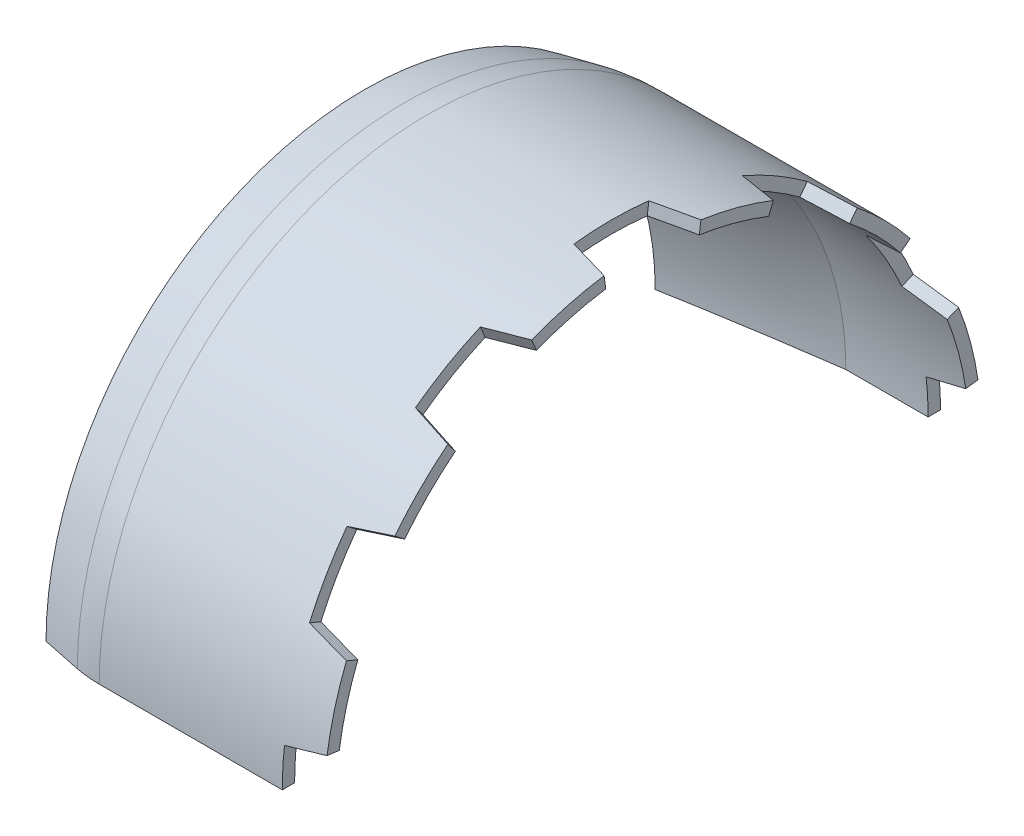
from build123d import *
from build123d.topology import SkipClean

# Parameters (mm, degrees)
FILLET1_R                      = 30
BOSS_EXTRUDE1_DEPTH            = 5
DRAFT1_ANGLE                   = 15
CIRPATTERN1_COUNT              = 12
DRAFT1_OF_CIRPATTERN1_2_ANGLE  = 15
DRAFT1_OF_CIRPATTERN1_3_ANGLE  = 15
DRAFT1_OF_CIRPATTERN1_4_ANGLE  = 15
DRAFT1_OF_CIRPATTERN1_5_ANGLE  = 15
DRAFT1_OF_CIRPATTERN1_6_ANGLE  = 15
DRAFT1_OF_CIRPATTERN1_7_ANGLE  = 15
DRAFT1_OF_CIRPATTERN1_8_ANGLE  = 15
DRAFT1_OF_CIRPATTERN1_9_ANGLE  = 15
DRAFT1_OF_CIRPATTERN1_10_ANGLE = 15
DRAFT1_OF_CIRPATTERN1_11_ANGLE = 15
DRAFT1_OF_CIRPATTERN1_12_ANGLE = 15
CUT_EXTRUDE1_START             = -65
SKETCH3_OUTSIDE_W              = 209.37
SKETCH3_OUTSIDE_H              = 209.37
CUT_EXTRUDE1_DEPTH             = 70


with BuildPart() as part:
    # Sketch1 → Revolve1 (revolve)
    with BuildSketch(Plane.XY, mode=Mode.PRIVATE) as revolve1_sk:
        with BuildLine():
            add(Edge.make_bspline(
                [(110, 77.45), (110.06679598, 77.462758264), (110.199999634, 77.490001626), (110.399807309, 77.530856913), (110.601491881, 77.566698809), (110.798508105, 77.623301255), (111.067180729, 77.671047252), (111.332818291, 77.728957106), (111.601493273, 77.776692616), (111.798502962, 77.833324125), (112.000211696, 77.869058569), (112.199929416, 77.910313895), (112.400070642, 77.94968585), (112.599788017, 77.990942706), (112.801498132, 78.026671007), (112.998502606, 78.083325711), (113.200208347, 78.119073462), (113.399943178, 78.160252691), (113.600018939, 78.199915776), (113.799981065, 78.240084206), (114.000056801, 78.279747399), (114.19979173, 78.320926197), (114.401497106, 78.356675571), (114.598502951, 78.413324175), (114.800207988, 78.449075058), (114.999944271, 78.490247831), (115.200014927, 78.529933617), (115.399996019, 78.570017702), (115.66666932, 78.623321532), (115.93333068, 78.676678468), (116.200003981, 78.729982298), (116.399985073, 78.770066382), (116.600055727, 78.809752175), (116.799792017, 78.850924917), (117.001497028, 78.886675917), (117.198502972, 78.943324083), (117.400207983, 78.979075081), (117.599944271, 79.020247831), (117.800014933, 79.059933594), (117.999995999, 79.100017793), (118.200001072, 79.139995233), (118.599998354, 79.220007319), (119.000000352, 79.299997981), (119.399999769, 79.380001322), (119.600000864, 79.419995059), (119.799996775, 79.460018442), (120.000012038, 79.499931172), (120.199955075, 79.540256871), (120.400167663, 79.579041345), (120.598813231, 79.623452318), (120.801186769, 79.646547682), (120.999832337, 79.690958656), (121.200044925, 79.729743127), (121.399987961, 79.770068835), (121.60000323, 79.809981532), (121.799999119, 79.850005037), (122.000000294, 79.889998321), (122.199999706, 79.930001679), (122.383325982, 79.966660563), (122.499982502, 79.990003775), (122.549974744, 80)],
                knots=[0.785532448, 0.785532448, 0.785532448, 0.785532448, 0.786606766, 0.787681084, 0.788755402, 0.789841279, 0.790915597, 0.793064233, 0.794138551, 0.795224429, 0.796298747, 0.797373065, 0.798447383, 0.799521701, 0.800596019, 0.801681896, 0.802756214, 0.803830532, 0.80490485, 0.805979168, 0.807053486, 0.808127804, 0.809202122, 0.810287999, 0.811362317, 0.812436636, 0.813510954, 0.814585272, 0.81565959, 0.817808226, 0.818882544, 0.819956862, 0.82103118, 0.822105498, 0.823179816, 0.824265693, 0.825340011, 0.826414329, 0.827488647, 0.828562965, 0.829637283, 0.830711601, 0.835008874, 0.836083192, 0.83715751, 0.838231828, 0.839306146, 0.840380464, 0.841454782, 0.8425291, 0.843594341, 0.844668659, 0.845742977, 0.846817295, 0.847891613, 0.848965931, 0.850040249, 0.851114567, 0.852188885, 0.852994493, 0.852994493, 0.852994493, 0.852994493], degree=3))
            Line((110, 77.45), (110, 70.659443335))
            add(Edge.make_bspline(
                [(110, 70.659443335), (110.051885566, 70.668180822), (110.167763625, 70.68872725), (110.349523568, 70.714997808), (110.539653731, 70.763669129), (110.733770096, 70.791720551), (110.925877478, 70.826475418), (111.119988954, 70.854552124), (111.310138801, 70.903121629), (111.504180998, 70.931556707), (111.696564878, 70.964881298), (111.888950575, 70.998196488), (112.082987301, 71.026659869), (112.273157347, 71.075124886), (112.531641934, 71.11304167), (112.787516212, 71.160772453), (113.046002752, 71.198679133), (113.236167385, 71.247172151), (113.430224123, 71.275532008), (113.622535313, 71.309232614), (113.815197283, 71.341118696), (114.007508188, 71.374820776), (114.20156607, 71.403174715), (114.391726383, 71.451690079), (114.585780643, 71.480062757), (114.778106006, 71.513690047), (114.970713752, 71.545856618), (115.163227378, 71.57851006), (115.355835104, 71.610676734), (115.548160548, 71.644303609), (115.742214505, 71.67267785), (115.932375954, 71.721187338), (116.126429631, 71.749563033), (116.318756196, 71.783184104), (116.511359715, 71.815372545), (116.703889049, 71.847944725), (116.960621206, 71.891237859), (117.217343471, 71.934582158), (117.474075627, 71.977875292), (117.666604962, 72.010447471), (117.859208479, 72.042635919), (118.05153505, 72.07625696), (118.245588705, 72.104632768), (118.435750235, 72.153141833), (118.629803891, 72.181517639), (118.82213046, 72.215138688), (119.014733983, 72.247327106), (119.207263297, 72.279899397), (119.399812494, 72.31236883), (119.784900235, 72.377362812), (120.169991868, 72.442336157), (120.555081398, 72.507321709), (120.747627261, 72.539806853), (120.94016902, 72.572320517), (121.132726097, 72.604727732), (121.325226005, 72.637532223), (121.517939268, 72.668854058), (121.709315773, 72.705605444), (121.903643016, 72.721851243), (122.095019521, 72.758602629), (122.287732784, 72.789924462), (122.480232691, 72.822728961), (122.672789773, 72.855136145), (122.865331515, 72.887649925), (123.05787744, 72.920134634), (123.250421971, 72.952629033), (123.442967897, 72.985113742), (123.635509639, 73.017627523), (123.82806672, 73.050034704), (124.020566627, 73.082839212), (124.213279894, 73.114161013), (124.404656382, 73.150912516), (124.598983687, 73.167157885), (124.79035996, 73.203910883), (124.98307409, 73.23522669), (125.175570762, 73.268053675), (125.368139919, 73.300376944), (125.560636595, 73.333203899), (125.753350708, 73.364519822), (125.944727043, 73.401272389), (126.139054118, 73.417519359), (126.330431471, 73.454264852), (126.587378183, 73.496057211), (126.843928932, 73.540601236), (127.100875322, 73.582395829), (127.292253557, 73.619135196), (127.486577364, 73.635404877), (127.741942359, 73.684329085), (127.999325479, 73.723088713), (128.254691564, 73.772005344), (128.449012391, 73.788295732), (128.704378458, 73.837212498), (128.961761153, 73.875975073), (129.217127225, 73.924891795), (129.411448036, 73.941182301), (129.602837526, 73.977843446), (129.795505233, 74.009481857), (129.98817434, 74.04111054), (130.179559644, 74.077800784), (130.373895725, 74.093985168), (130.565227855, 74.131044926), (130.758110028, 74.16119295), (130.949438419, 74.198278698), (131.14378938, 74.214359672), (131.335118521, 74.251440209), (131.527997688, 74.281609116), (131.719341055, 74.318590789), (131.978583116, 74.340572085), (132.231771971, 74.400758969), (132.491013633, 74.422743037), (132.682358103, 74.459717044), (132.875233151, 74.489914578), (133.066577619, 74.526888594), (133.325819288, 74.548872611), (133.579008295, 74.609058447), (133.838249971, 74.631042408), (134.029594418, 74.668016579), (134.222469549, 74.698213534), (134.413813709, 74.735189698), (134.608108919, 74.751658106), (134.799646722, 74.787288585), (134.991204892, 74.822777525), (135.185439345, 74.839668158), (135.377007721, 74.875086169), (135.568504741, 74.911000063), (135.762952059, 74.926411428), (135.953185876, 74.96724372), (136.147633173, 74.982655228), (136.339130275, 75.018568549), (136.530698343, 75.053988706), (136.789862004, 75.07651482), (137.043113602, 75.13626569), (137.302277271, 75.158791751), (137.493845318, 75.194212053), (137.685342498, 75.230124835), (137.879789507, 75.245538344), (138.070024403, 75.286363139), (138.329465202, 75.306963337), (138.582494602, 75.368258326), (138.841934984, 75.388861429), (139.032171032, 75.42967821), (139.226613759, 75.445121483), (139.418127023, 75.480922486), (139.6096351, 75.516759539), (139.804093302, 75.532095268), (139.994272403, 75.573307803), (140.188926912, 75.587279335), (140.37910609, 75.628491324), (140.638566347, 75.648956304), (140.891579327, 75.710365405), (141.151041181, 75.730819289), (141.341215956, 75.77206188), (141.535886821, 75.78591975), (141.726004669, 75.827557945), (141.920690661, 75.841310693), (142.110804714, 75.882975261), (142.305490705, 75.896728011), (142.495608554, 75.938366202), (142.690279417, 75.952224083), (142.880454198, 75.993466633), (143.139916022, 76.013920722), (143.392928397, 76.075334026), (143.652390191, 76.095788325), (143.842565055, 76.137030298), (144.037235611, 76.150890319), (144.227354613, 76.192520496), (144.422036315, 76.206303053), (144.612166432, 76.247855984), (144.806792682, 76.262023899), (145.060401779, 76.315430418), (145.320449369, 76.327953852), (145.574058436, 76.38136058), (145.768684768, 76.395527919), (145.958814575, 76.437083006), (146.153497432, 76.450857546), (146.343612113, 76.49251775), (146.538298737, 76.506266102), (146.728413418, 76.547926307), (146.923096274, 76.561700843), (147.11322608, 76.603255941), (147.307852418, 76.617423239), (147.561461455, 76.670830173), (147.821508446, 76.683357779), (148.075119077, 76.736753632), (148.269741043, 76.750951313), (148.459887203, 76.792392764), (148.654509247, 76.806589903), (148.844851686, 76.846667346), (149.03814383, 76.866246389), (149.231430844, 76.885861077), (149.421788758, 76.925830977), (149.616354264, 76.940421024), (149.806711907, 76.98039281), (149.935753121, 76.993482782), (150, 77)],
                knots=[0.777120663, 0.777120663, 0.777120663, 0.777120663, 0.777989104, 0.779063422, 0.780149299, 0.781223617, 0.782297935, 0.783372253, 0.78445813, 0.785532448, 0.786606766, 0.787681084, 0.788755402, 0.789841279, 0.790915597, 0.793064233, 0.794138551, 0.795224429, 0.796298747, 0.797373065, 0.798447383, 0.799521701, 0.800596019, 0.801681896, 0.802756214, 0.803830532, 0.80490485, 0.805979168, 0.807053486, 0.808127804, 0.809202122, 0.810287999, 0.811362317, 0.812436636, 0.813510954, 0.814585272, 0.81565959, 0.817808226, 0.818882544, 0.819956862, 0.82103118, 0.822105498, 0.823179816, 0.824265693, 0.825340011, 0.826414329, 0.827488647, 0.828562965, 0.829637283, 0.830711601, 0.835008874, 0.836083192, 0.83715751, 0.838231828, 0.839306146, 0.840380464, 0.841454782, 0.8425291, 0.843594341, 0.844668659, 0.845742977, 0.846817295, 0.847891613, 0.848965931, 0.850040249, 0.851114567, 0.852188885, 0.853263204, 0.854337522, 0.85541184, 0.856486158, 0.857560476, 0.858625717, 0.859700035, 0.860774353, 0.861848671, 0.862922989, 0.863997307, 0.865071625, 0.866145943, 0.867211184, 0.868285502, 0.86935982, 0.871508456, 0.872582774, 0.873657092, 0.874722333, 0.875796651, 0.877945288, 0.879019606, 0.880084847, 0.881159165, 0.883307801, 0.884382119, 0.88544736, 0.886521678, 0.887595996, 0.888670314, 0.889744632, 0.890809873, 0.891884191, 0.892958509, 0.894032827, 0.895098068, 0.896172386, 0.897246704, 0.898321022, 0.899386263, 0.901534899, 0.90260014, 0.903674458, 0.904748776, 0.905823094, 0.906888335, 0.909036972, 0.910102213, 0.911176531, 0.912250849, 0.913325167, 0.914390408, 0.915464726, 0.916539044, 0.917604285, 0.918678603, 0.919752921, 0.920818162, 0.92189248, 0.922957721, 0.924032039, 0.925106357, 0.926171598, 0.928320234, 0.929385475, 0.930459793, 0.931534111, 0.932599352, 0.93367367, 0.934738911, 0.936887547, 0.937952788, 0.939027106, 0.940092347, 0.941166665, 0.942240983, 0.943306224, 0.944380542, 0.945445783, 0.946520101, 0.947585342, 0.949733978, 0.950799219, 0.951873538, 0.952938778, 0.954013097, 0.955078338, 0.956152656, 0.957217897, 0.958292215, 0.959357456, 0.960431774, 0.961497015, 0.963645651, 0.964710892, 0.96578521, 0.966850451, 0.967924769, 0.96899001, 0.970064328, 0.971129569, 0.972203887, 0.974334369, 0.975408687, 0.976473928, 0.977548246, 0.978613487, 0.979687805, 0.980753046, 0.981827364, 0.982892605, 0.983966923, 0.985032164, 0.986106482, 0.988236964, 0.989311282, 0.990376523, 0.991450841, 0.992516082, 0.9935904, 0.994655641, 0.995720882, 0.9967952, 0.997860441, 0.998934759, 1, 1, 1, 1], degree=3))
            Line((150, 77), (170, 77))
            Line((170, 77), (170, 80))
            Line((170, 80), (122.549974744, 80))
        make_face()
    revolve(revolve1_sk.sketch.rotate(Axis((0, 0, 0), (1, 0, 0)), 90), axis=Axis((0, 0, 0), (1, 0, 0)))

    # Fillet1
    fillet1_edges = [part.edges().sort_by_distance(p)[0] for p in [
        (122.549974744, 0, -80),
    ]]
    fillet(fillet1_edges, radius=FILLET1_R)

    # Sketch2 → Boss-Extrude1 (add, symmetric)
    with BuildSketch(Plane(origin=(175, 0, 0), x_dir=(0, 0, -1), z_dir=(1, 0, 0))):
        with BuildLine():
            Line((29.466624292, -71.138724003), (30.614674589, -73.910362601))
            ThreePointArc((30.614674589, -73.910362601), (20.705523608, -77.274066103), (10.442095378, -79.31558891))
            Line((10.442095378, -79.31558891), (10.050516801, -76.341254326))
            ThreePointArc((10.050516801, -76.341254326), (19.929066473, -74.376288624), (29.466624292, -71.138724003))
        make_face()
    boss_extrude1 = extrude(amount=BOSS_EXTRUDE1_DEPTH, both=True)

    # Draft1
    draft1_faces = [part.faces().sort_by_distance(p)[0] for p in [
        (175, -72.524543302, -30.040649441),
        (175, -77.828421618, -10.246306089),
    ]]
    draft(draft1_faces, Plane(origin=(175, 0, 0), x_dir=(0, 0, 1), z_dir=(1, 0, 0)), DRAFT1_ANGLE)

    # CirPattern1: Boss-Extrude1 ×12 about axis
    with SkipClean():  # the faces are left unmerged after this step: merging them gives an invalid solid
        cirpattern1_axis = Axis((0, 0, 0), (1, 0, 0))
        for i in range(1, CIRPATTERN1_COUNT):
            add(boss_extrude1.rotate(cirpattern1_axis, i * 360 / CIRPATTERN1_COUNT))

    # Draft1 of CirPattern1 2
    draft1_of_cirpattern1_2_faces = [part.faces().sort_by_distance(p)[0] for p in [
        (175, -47.787772177, -62.278237213),
        (175, -62.278237213, -47.787772177),
    ]]
    draft(draft1_of_cirpattern1_2_faces, Plane(origin=(175, 0, 0), x_dir=(0, -0.49999999999999994, 0.8660254037844387), z_dir=(1, 0, 0)), DRAFT1_OF_CIRPATTERN1_2_ANGLE)

    # Draft1 of CirPattern1 3
    draft1_of_cirpattern1_3_faces = [part.faces().sort_by_distance(p)[0] for p in [
        (175, -10.246306089, -77.828421618),
        (175, -30.040649441, -72.524543302),
    ]]
    draft(draft1_of_cirpattern1_3_faces, Plane(origin=(175, 0, 0), x_dir=(0, -0.8660254037844386, 0.5000000000000001), z_dir=(1, 0, 0)), DRAFT1_OF_CIRPATTERN1_3_ANGLE)

    # Draft1 of CirPattern1 4
    draft1_of_cirpattern1_4_faces = [part.faces().sort_by_distance(p)[0] for p in [
        (175, 30.040649441, -72.524543302),
        (175, 10.246306089, -77.828421618),
    ]]
    draft(draft1_of_cirpattern1_4_faces, Plane(origin=(175, 0, 0), x_dir=(0, -1, 0), z_dir=(1, 0, 0)), DRAFT1_OF_CIRPATTERN1_4_ANGLE)

    # Draft1 of CirPattern1 5
    draft1_of_cirpattern1_5_faces = [part.faces().sort_by_distance(p)[0] for p in [
        (175, 62.278237213, -47.787772177),
        (175, 47.787772177, -62.278237213),
    ]]
    draft(draft1_of_cirpattern1_5_faces, Plane(origin=(175, 0, 0), x_dir=(0, -0.8660254037844387, -0.4999999999999998), z_dir=(1, 0, 0)), DRAFT1_OF_CIRPATTERN1_5_ANGLE)

    # Draft1 of CirPattern1 6
    draft1_of_cirpattern1_6_faces = [part.faces().sort_by_distance(p)[0] for p in [
        (175, 77.828421618, -10.246306089),
        (175, 72.524543302, -30.040649441),
    ]]
    draft(draft1_of_cirpattern1_6_faces, Plane(origin=(175, 0, 0), x_dir=(0, -0.49999999999999994, -0.8660254037844387), z_dir=(1, 0, 0)), DRAFT1_OF_CIRPATTERN1_6_ANGLE)

    # Draft1 of CirPattern1 7
    draft1_of_cirpattern1_7_faces = [part.faces().sort_by_distance(p)[0] for p in [
        (175, 72.524543302, 30.040649441),
        (175, 77.828421618, 10.246306089),
    ]]
    draft(draft1_of_cirpattern1_7_faces, Plane(origin=(175, 0, 0), x_dir=(0, 0, -1), z_dir=(1, 0, 0)), DRAFT1_OF_CIRPATTERN1_7_ANGLE)

    # Draft1 of CirPattern1 8
    draft1_of_cirpattern1_8_faces = [part.faces().sort_by_distance(p)[0] for p in [
        (175, 47.787772177, 62.278237213),
        (175, 62.278237213, 47.787772177),
    ]]
    draft(draft1_of_cirpattern1_8_faces, Plane(origin=(175, 0, 0), x_dir=(0, 0.5000000000000001, -0.8660254037844386), z_dir=(1, 0, 0)), DRAFT1_OF_CIRPATTERN1_8_ANGLE)

    # Draft1 of CirPattern1 9
    draft1_of_cirpattern1_9_faces = [part.faces().sort_by_distance(p)[0] for p in [
        (175, 10.246306089, 77.828421618),
        (175, 30.040649441, 72.524543302),
    ]]
    draft(draft1_of_cirpattern1_9_faces, Plane(origin=(175, 0, 0), x_dir=(0, 0.8660254037844384, -0.5000000000000004), z_dir=(1, 0, 0)), DRAFT1_OF_CIRPATTERN1_9_ANGLE)

    # Draft1 of CirPattern1 10
    draft1_of_cirpattern1_10_faces = [part.faces().sort_by_distance(p)[0] for p in [
        (175, -30.040649441, 72.524543302),
        (175, -10.246306089, 77.828421618),
    ]]
    draft(draft1_of_cirpattern1_10_faces, Plane.YZ.offset(175), DRAFT1_OF_CIRPATTERN1_10_ANGLE)

    # Draft1 of CirPattern1 11
    draft1_of_cirpattern1_11_faces = [part.faces().sort_by_distance(p)[0] for p in [
        (175, -62.278237213, 47.787772177),
        (175, -47.787772177, 62.278237213),
    ]]
    draft(draft1_of_cirpattern1_11_faces, Plane(origin=(175, 0, 0), x_dir=(0, 0.8660254037844386, 0.5000000000000001), z_dir=(1, 0, 0)), DRAFT1_OF_CIRPATTERN1_11_ANGLE)

    # Draft1 of CirPattern1 12
    draft1_of_cirpattern1_12_faces = [part.faces().sort_by_distance(p)[0] for p in [
        (175, -77.828421618, 10.246306089),
        (175, -72.524543302, 30.040649441),
    ]]
    draft(draft1_of_cirpattern1_12_faces, Plane(origin=(175, 0, 0), x_dir=(0, 0.5000000000000004, 0.8660254037844384), z_dir=(1, 0, 0)), DRAFT1_OF_CIRPATTERN1_12_ANGLE)

    # Sketch3 outside → Cut-Extrude1 (cut)
    with SkipClean():  # the faces are left unmerged after this step: merging them gives an invalid solid
        with BuildSketch(Plane(origin=(175, 0, 0), x_dir=(0, 0, -1), z_dir=(1, 0, 0)).offset(CUT_EXTRUDE1_START)):
            Rectangle(SKETCH3_OUTSIDE_W, SKETCH3_OUTSIDE_H)
            with BuildLine():
                Line((0, 0), (-80, 0))
                ThreePointArc((-80, 0), (0, 80), (80, 0))
                Line((80, 0), (0, 0))
            make_face(mode=Mode.SUBTRACT)
        extrude(amount=CUT_EXTRUDE1_DEPTH, mode=Mode.SUBTRACT)


solid = part.part
